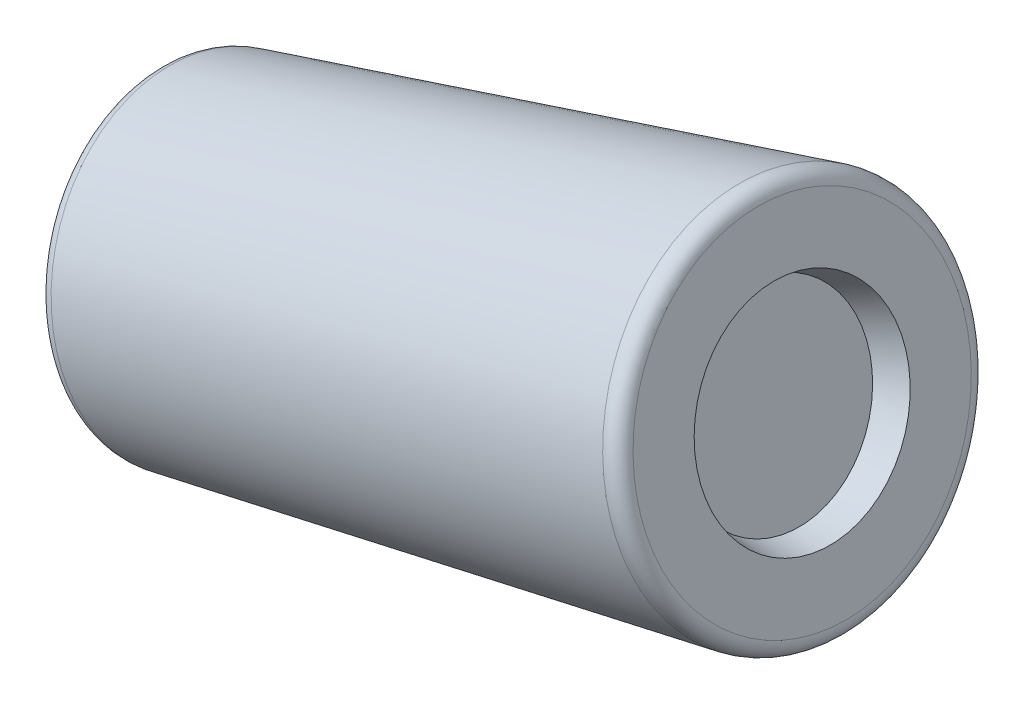
from build123d import *

# Parameters (mm, degrees)
ESQUISSE3_R             = 1.75
ENL_V_MAT_EXTRU_1_DEPTH = 0.5
ENL_V_MAT_EXTRU_1_DRAFT = -16
CONG_1_R                = 0.25


with BuildPart() as part:
    # Esquisse1 → Base-Révolution (revolve)
    with BuildSketch(Plane.XY):
        Polygon((-3.671011888, 20.208682969), (-13.724147668, 17.415887566), (-13.132038717, 14.901290759), (-2.868011513, 17.318148347), align=None)
    revolve(axis=Axis((5.13679497, 22.65552175, 0), (-0.9635115404771745, -0.2676667916782024, 0)))


with BuildPart() as enl_v_mat_extru_1_tool:
    # Esquisse3 → Enlèv. mat.-Extru.1 (with draft: the straight prism first)
    with BuildSketch(Plane(origin=(1.80645753, 0.491612486, 0), x_dir=(0, 0, -1), z_dir=(0.9635115404771745, 0.2676667916782024, 0))):
        with Locations((0, 20.463761621)):
            Circle(ESQUISSE3_R)
    extrude(amount=-ENL_V_MAT_EXTRU_1_DEPTH)
    # Enlèv. mat.-Extru.1: the draft: its side faces are tilted about the plane it starts from
    enl_v_mat_extru_1_sides = [enl_v_mat_extru_1_tool.faces().sort_by_distance(p)[0] for p in [
        (-3.911889774, 20.141766271, 1.75),
    ]]
    draft(enl_v_mat_extru_1_sides, Plane(origin=(1.80645753, 0.491612486, 0), x_dir=(0, 0, -1), z_dir=(0.9635115404771745, 0.2676667916782024, 0)), ENL_V_MAT_EXTRU_1_DRAFT)


with BuildPart() as part_1:
    add(part.part)

    # Enlèv. mat.-Extru.1: cut by enl_v_mat_extru_1_tool
    add(enl_v_mat_extru_1_tool.part, mode=Mode.SUBTRACT)

    # Congé1
    cong_1_edges = [part_1.edges().sort_by_distance(p)[0] for p in [
        (-14.513911863, 19.875575073, 0),
        (-4.474012264, 23.09921759, 0),
    ]]
    fillet(cong_1_edges, radius=CONG_1_R)


solid = part_1.part
